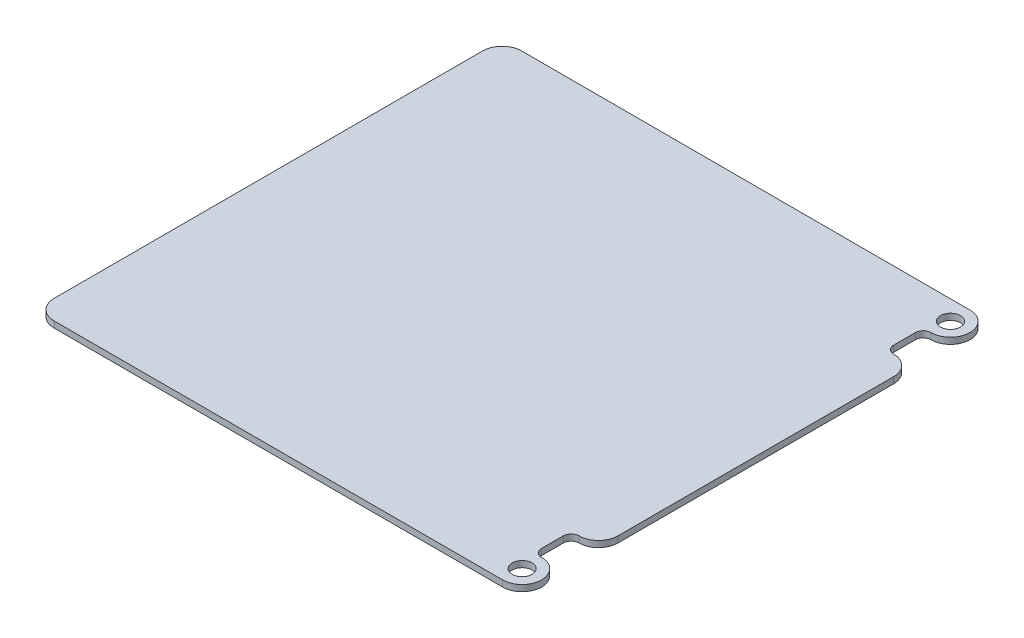
from build123d import *

# Parameters (mm, degrees)
SKETCH_1_R      = 2.55
EXTRUDE_1_DEPTH = 1.6


with BuildPart() as part:
    # 草图1 → 凸台-拉伸1 (new body)
    with BuildSketch(Plane(origin=(0, 0, 0), x_dir=(1, 0, 0), z_dir=(0, 1, 0))):
        with BuildLine():
            Line((-738.301002862, -638.492276663), (-623.301002862, -638.492276663))
            ThreePointArc((-623.301002862, -638.492276663), (-619.765468956, -637.027810569), (-618.301002862, -633.492276663))
            ThreePointArc((-618.301002862, -633.492276663), (-619.765468956, -629.956742757), (-623.301002862, -628.492276663))
            ThreePointArc((-623.301002862, -628.492276663), (-624.715216424, -627.906490225), (-625.301002862, -626.492276663))
            Line((-625.301002862, -626.492276663), (-625.301002862, -620.922276663))
            ThreePointArc((-625.301002862, -620.922276663), (-624.715216424, -619.5080631), (-623.301002862, -618.922276663))
            ThreePointArc((-623.301002862, -618.922276663), (-619.765468956, -617.457810569), (-618.301002862, -613.922276663))
            Line((-618.301002862, -613.922276663), (-618.301002862, -543.193402957))
            ThreePointArc((-618.301002862, -543.193402957), (-619.765468956, -539.657869051), (-623.301002862, -538.193402957))
            ThreePointArc((-623.301002862, -538.193402957), (-624.715216424, -537.607616519), (-625.301002862, -536.193402957))
            Line((-625.301002862, -536.193402957), (-625.301002862, -530.623402957))
            ThreePointArc((-625.301002862, -530.623402957), (-624.715216424, -529.209189395), (-623.301002862, -528.623402957))
            ThreePointArc((-623.301002862, -528.623402957), (-619.765468956, -527.158936863), (-618.301002862, -523.623402957))
            ThreePointArc((-618.301002862, -523.623402957), (-619.765468956, -520.087869051), (-623.301002862, -518.623402957))
            Line((-623.301002862, -518.623402957), (-738.36571736, -518.55783981))
            ThreePointArc((-738.36571736, -518.55783981), (-741.901251266, -520.022305904), (-743.36571736, -523.55783981))
            Line((-743.36571736, -523.55783981), (-743.36571736, -633.55783981))
            ThreePointArc((-743.36571736, -633.55783981), (-741.855315445, -637.073994954), (-738.301002862, -638.492276663))
        make_face()
        with Locations(Location((-623.301002862, -633.492276663, 0), (0, 0, 270))):
            Circle(SKETCH_1_R, mode=Mode.SUBTRACT)
        with Locations(Location((-623.301002862, -523.623402957, 0), (0, 0, 270))):
            Circle(SKETCH_1_R, mode=Mode.SUBTRACT)
    extrude(amount=EXTRUDE_1_DEPTH)


solid = part.part
